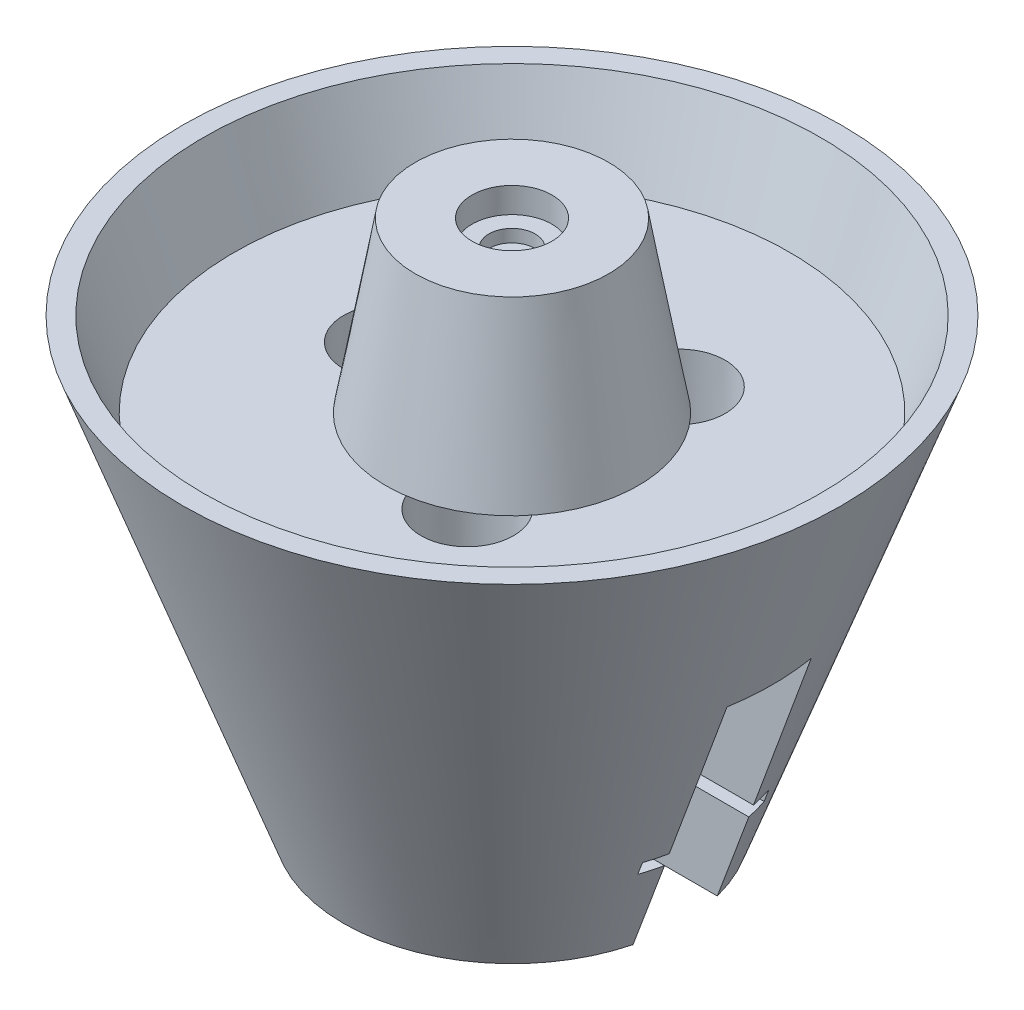
from build123d import *

# Parameters (mm, degrees)
SKETCH1_R                    = 40
BOSS_EXTRUDE1_DEPTH          = 105
BOSS_EXTRUDE1_DRAFT          = -20
SKETCH2_R                    = 10
CUT_EXTRUDE1_DEPTH           = 20
SKETCH3_W                    = 90.152785451
SKETCH3_H                    = 60
CUT_EXTRUDE2_DEPTH           = 10
SKETCH4_R                    = 9.5
CUT_EXTRUDE3_DEPTH           = 105
CUT_EXTRUDE3_DRAFT           = 1
CUT_EXTRUDE3_PROFILE_2_DEPTH = 105
CUT_EXTRUDE3_PROFILE_2_DRAFT = 1
CUT_EXTRUDE3_PROFILE_3_DEPTH = 105
CUT_EXTRUDE3_PROFILE_3_DRAFT = 1
SKETCH7_R                    = 17.5
CUT_EXTRUDE5_DEPTH           = 80
CUT_EXTRUDE6_DEPTH           = 3
SKETCH9_R                    = 73.216874598
CUT_EXTRUDE7_DEPTH           = 20
CUT_EXTRUDE7_TAPER           = 20
CUT_EXTRUDE7_OTHER_WAY_DEPTH = 20
CUT_EXTRUDE7_OTHER_WAY_TAPER = 20
SKETCH10_R                   = 30
BOSS_EXTRUDE2_DEPTH          = 40
BOSS_EXTRUDE2_TAPER          = 10
SKETCH11_R                   = 9.5
CUT_EXTRUDE8_DEPTH           = 6
SKETCH12_R                   = 5.5
CUT_EXTRUDE9_DEPTH           = 3


with BuildPart() as part:
    # Sketch1 → Boss-Extrude1 (with draft: the straight prism first)
    with BuildSketch(Plane(origin=(0, 0, 0), x_dir=(1, 0, 0), z_dir=(0, 1, 0))):
        Circle(SKETCH1_R)
    extrude(amount=BOSS_EXTRUDE1_DEPTH)
    # Boss-Extrude1: the draft: its side faces are tilted about the plane it starts from
    boss_extrude1_sides = [part.faces().sort_by_distance(p)[0] for p in [
        (-40, 52.5, 0),
    ]]
    draft(boss_extrude1_sides, Plane(origin=(0, 0, 0), x_dir=(1, 0, 0), z_dir=(0, 1, 0)), BOSS_EXTRUDE1_DRAFT)

    # Sketch2 → Cut-Extrude1 (cut)
    with BuildSketch(Plane.XZ):
        with Locations(Location((0, 0, 0), (0, 0, 270))):
            Circle(SKETCH2_R)
    extrude(amount=-CUT_EXTRUDE1_DEPTH, mode=Mode.SUBTRACT)

    # Sketch3 → Cut-Extrude2 (cut, symmetric)
    with BuildSketch(Plane.XY):
        with Locations((45.076392725, 30)):
            Rectangle(SKETCH3_W, SKETCH3_H)
    extrude(amount=CUT_EXTRUDE2_DEPTH, both=True, mode=Mode.SUBTRACT)


with BuildPart() as cut_extrude3_tool:
    # Sketch4 → Cut-Extrude3 (with draft: the straight prism first)
    with BuildSketch(Plane.XZ):
        with Locations((14.5, 25.11473671)):
            Circle(SKETCH4_R)
    extrude(amount=-CUT_EXTRUDE3_DEPTH)
    # Cut-Extrude3: the draft: its side faces are tilted about the plane it starts from
    cut_extrude3_sides = [cut_extrude3_tool.faces().sort_by_distance(p)[0] for p in [
        (5, 52.5, 25.11473671),
    ]]
    draft(cut_extrude3_sides, Plane.XZ, CUT_EXTRUDE3_DRAFT)


with BuildPart() as part_1:
    add(part.part)

    # Cut-Extrude3: cut by cut_extrude3_tool
    add(cut_extrude3_tool.part, mode=Mode.SUBTRACT)


with BuildPart() as cut_extrude3_profile_2_tool:
    # Sketch4 → Cut-Extrude3 profile 2 (with draft: the straight prism first)
    with BuildSketch(Plane.XZ):
        with Locations((-29, 0)):
            Circle(SKETCH4_R)
    extrude(amount=-CUT_EXTRUDE3_PROFILE_2_DEPTH)
    # Cut-Extrude3 profile 2: the draft: its side faces are tilted about the plane it starts from
    cut_extrude3_profile_2_sides = [cut_extrude3_profile_2_tool.faces().sort_by_distance(p)[0] for p in [
        (-38.5, 52.5, 0),
    ]]
    draft(cut_extrude3_profile_2_sides, Plane.XZ, CUT_EXTRUDE3_PROFILE_2_DRAFT)


with BuildPart() as part_2:
    add(part_1.part)

    # Cut-Extrude3 profile 2: cut by cut_extrude3_profile_2_tool
    add(cut_extrude3_profile_2_tool.part, mode=Mode.SUBTRACT)


with BuildPart() as cut_extrude3_profile_3_tool:
    # Sketch4 → Cut-Extrude3 profile 3 (with draft: the straight prism first)
    with BuildSketch(Plane.XZ):
        with Locations((14.5, -25.11473671)):
            Circle(SKETCH4_R)
    extrude(amount=-CUT_EXTRUDE3_PROFILE_3_DEPTH)
    # Cut-Extrude3 profile 3: the draft: its side faces are tilted about the plane it starts from
    cut_extrude3_profile_3_sides = [cut_extrude3_profile_3_tool.faces().sort_by_distance(p)[0] for p in [
        (5, 52.5, -25.11473671),
    ]]
    draft(cut_extrude3_profile_3_sides, Plane.XZ, CUT_EXTRUDE3_PROFILE_3_DRAFT)


with BuildPart() as part_3:
    add(part_2.part)

    # Cut-Extrude3 profile 3: cut by cut_extrude3_profile_3_tool
    add(cut_extrude3_profile_3_tool.part, mode=Mode.SUBTRACT)

    # Sketch7 → Cut-Extrude5 (cut)
    with BuildSketch(Plane.XZ.offset(-20)):
        with Locations(Location((0, 0, 0), (0, 0, 270))):
            Circle(SKETCH7_R)
    extrude(amount=-CUT_EXTRUDE5_DEPTH, mode=Mode.SUBTRACT)

    # Sketch8 → Cut-Extrude6 (cut)
    with BuildSketch(Plane(origin=(0, 20, 0), x_dir=(1, 0, 0), z_dir=(0, 1, 0))):
        with BuildLine():
            ThreePointArc((14.361406616, -10), (11.952028486, -12.782762419), (9.013878189, -15))
            Line((9.013878189, -15), (73.540166037, -15))
            Line((73.540166037, -15), (73.540166037, 15))
            Line((73.540166037, 15), (9.013878189, 15))
            ThreePointArc((9.013878189, 15), (11.952028486, 12.782762419), (14.361406616, 10))
            Line((14.361406616, 10), (0, 10))
            Line((0, 10), (0, -10))
            Line((0, -10), (14.361406616, -10))
        make_face()
        with BuildLine():
            ThreePointArc((14.361406616, 10), (11.952028486, 12.782762419), (9.013878189, 15))
            Line((9.013878189, 15), (0, 15))
            Line((0, 15), (0, 10))
            Line((0, 10), (14.361406616, 10))
        make_face()
        with BuildLine():
            Line((0, -10), (0, -15))
            Line((0, -15), (9.013878189, -15))
            ThreePointArc((9.013878189, -15), (11.952028486, -12.782762419), (14.361406616, -10))
            Line((14.361406616, -10), (0, -10))
        make_face()
    extrude(amount=CUT_EXTRUDE6_DEPTH, mode=Mode.SUBTRACT)

    # Sketch9 → Cut-Extrude7 (cut)
    with BuildSketch(Plane(origin=(0, 105, 0), x_dir=(1, 0, 0), z_dir=(0, 1, 0))):
        Circle(SKETCH9_R)
    extrude(amount=CUT_EXTRUDE7_DEPTH, taper=CUT_EXTRUDE7_TAPER, mode=Mode.SUBTRACT)

    # Sketch9 → Cut-Extrude7 other way (cut)
    with BuildSketch(Plane(origin=(0, 105, 0), x_dir=(1, 0, 0), z_dir=(0, 1, 0))):
        Circle(SKETCH9_R)
    extrude(amount=-CUT_EXTRUDE7_OTHER_WAY_DEPTH, taper=CUT_EXTRUDE7_OTHER_WAY_TAPER, mode=Mode.SUBTRACT)


with BuildPart() as body_2:
    # Sketch10 → Boss-Extrude2 (new body)
    with BuildSketch(Plane(origin=(0, 85, 0), x_dir=(1, 0, 0), z_dir=(0, 1, 0))):
        Circle(SKETCH10_R)
    extrude(amount=BOSS_EXTRUDE2_DEPTH, taper=BOSS_EXTRUDE2_TAPER)

    # Sketch11 → Cut-Extrude8 (cut)
    with BuildSketch(Plane(origin=(0, 125, 0), x_dir=(1, 0, 0), z_dir=(0, 1, 0))):
        with Locations(Location((0, 0, 0), (0, 0, 270))):
            Circle(SKETCH11_R)
    extrude(amount=-CUT_EXTRUDE8_DEPTH, mode=Mode.SUBTRACT)

    # Sketch12 → Cut-Extrude9 (cut)
    with BuildSketch(Plane(origin=(0, 119, 0), x_dir=(1, 0, 0), z_dir=(0, 1, 0))):
        with Locations(Location((0, 0, 0), (0, 0, 270))):
            Circle(SKETCH12_R)
    extrude(amount=-CUT_EXTRUDE9_DEPTH, mode=Mode.SUBTRACT)


solid = Compound([part_3.part, body_2.part])
